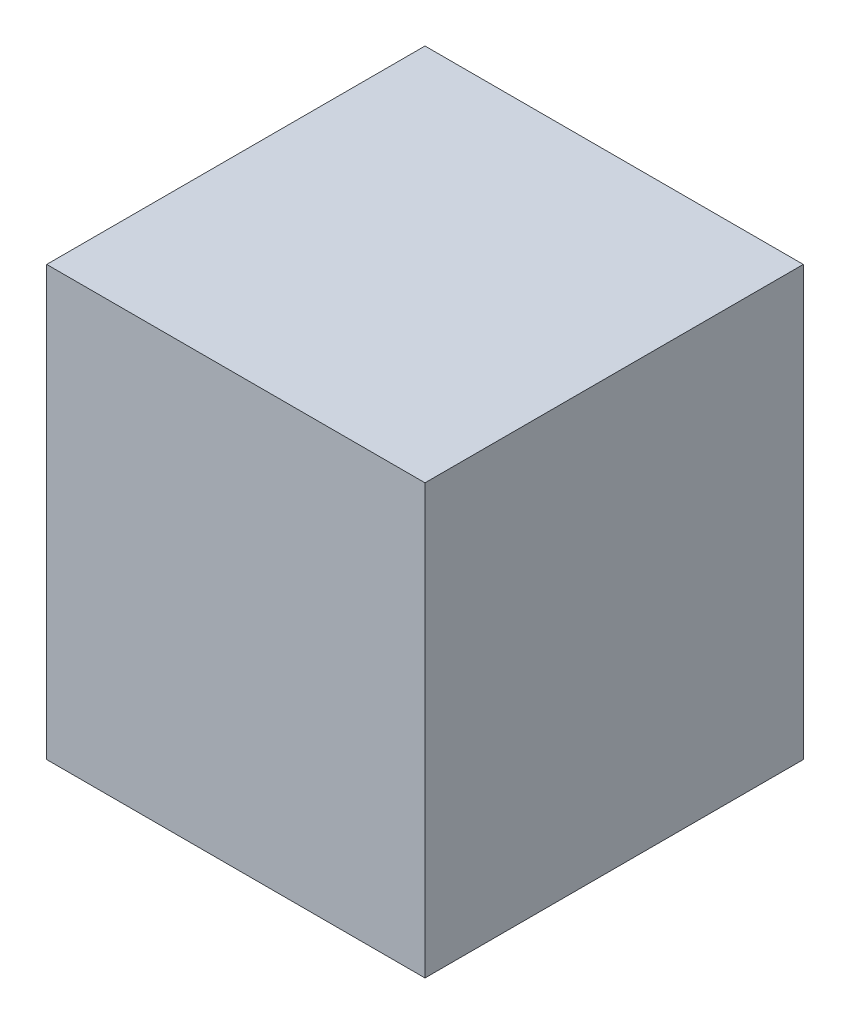
from build123d import *

# Parameters (mm, degrees)
SKETCH_1_W      = 5
SKETCH_1_H      = 5
EXTRUDE_1_DEPTH = 2.834


with BuildPart() as part:
    # 草图1 → 凸台-拉伸1 (new, symmetric)
    with BuildSketch(Plane(origin=(0, 0, 0), x_dir=(1, 0, 0), z_dir=(0, 1, 0))):
        Rectangle(SKETCH_1_W, SKETCH_1_H)
    extrude(amount=EXTRUDE_1_DEPTH, both=True)


solid = part.part
